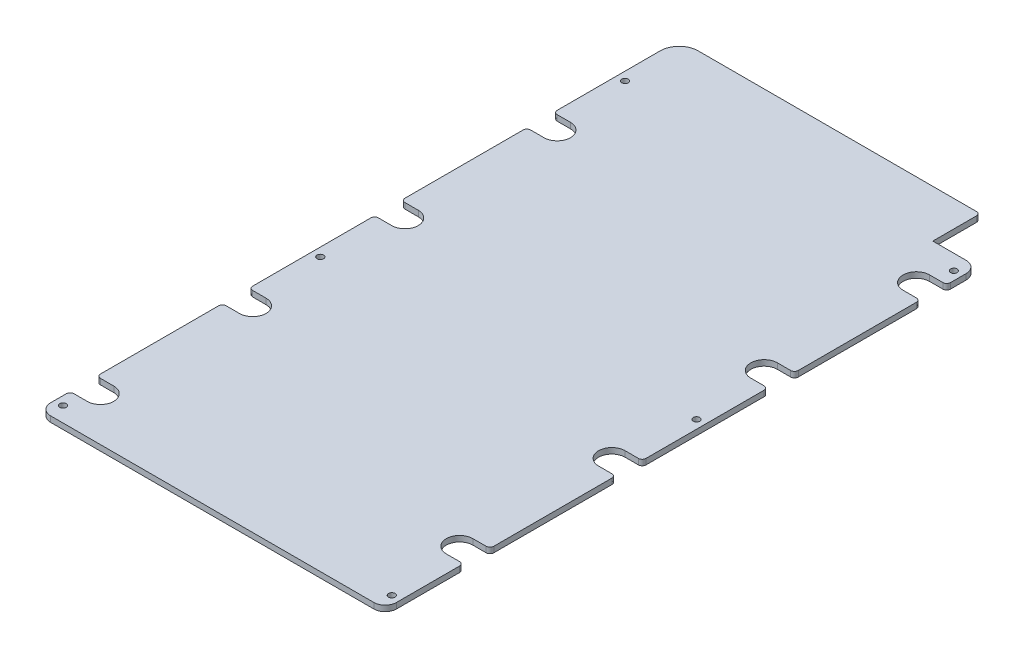
from build123d import *

# Parameters (mm, degrees)
SKETCH1_W                 = 158.69
SKETCH1_H                 = 25
BOSS_EXTRUDE1_DEPTH       = 3
FILLET1_R                 = 10
FILLET2_R                 = 6
F_4_CLEARANCE_HOLE1_D     = 3.4544
F_4_CLEARANCE_HOLE1_DEPTH = 3
F_4_CLEARANCE_HOLE1_TIP   = 1.037806461
FILLET3_R                 = 2


with BuildPart() as part:
    # Sketch1 → Boss-Extrude1 (new body)
    with BuildSketch(Plane(origin=(0, 0, 0), x_dir=(1, 0, 0), z_dir=(0, 1, 0))):
        with BuildLine():
            Line((-91.15, 34.609827366), (-82.15, 34.609827366))
            ThreePointArc((-82.15, 34.609827366), (-75.15, 27.609827366), (-82.15, 20.609827366))
            Line((-82.15, 20.609827366), (-91.15, 20.609827366))
            Line((-91.15, 20.609827366), (-91.15, -45.640172634))
            Line((-91.15, -45.640172634), (-82.15, -45.640172634))
            ThreePointArc((-82.15, -45.640172634), (-75.15, -52.640172634), (-82.15, -59.640172634))
            Line((-82.15, -59.640172634), (-91.15, -59.640172634))
            Line((-91.15, -59.640172634), (-91.15, -125.890172634))
            Line((-91.15, -125.890172634), (-82.15, -125.890172634))
            ThreePointArc((-82.15, -125.890172634), (-75.15, -132.890172634), (-82.15, -139.890172634))
            Line((-82.15, -139.890172634), (-91.15, -139.890172634))
            Line((-91.15, -139.890172634), (-91.15, -156.140172634))
            Line((-91.15, -156.140172634), (91.15, -156.140172634))
            Line((91.15, -156.140172634), (91.15, -114.890172634))
            Line((91.15, -114.890172634), (82.15, -114.890172634))
            ThreePointArc((82.15, -114.890172634), (75.15, -107.890172634), (82.15, -100.890172634))
            Line((82.15, -100.890172634), (91.15, -100.890172634))
            Line((91.15, -100.890172634), (91.15, -34.640172634))
            Line((91.15, -34.640172634), (82.15, -34.640172634))
            ThreePointArc((82.15, -34.640172634), (75.15, -27.640172634), (82.15, -20.640172634))
            Line((82.15, -20.640172634), (91.15, -20.640172634))
            Line((91.15, -20.640172634), (91.15, 45.609827366))
            Line((91.15, 45.609827366), (82.15, 45.609827366))
            ThreePointArc((82.15, 45.609827366), (75.15, 52.609827366), (82.15, 59.609827366))
            Line((82.15, 59.609827366), (91.15, 59.609827366))
            Line((91.15, 59.609827366), (91.15, 125.859827366))
            Line((91.15, 125.859827366), (82.15, 125.859827366))
            ThreePointArc((82.15, 125.859827366), (75.15, 132.859827366), (82.15, 139.859827366))
            Line((82.15, 139.859827366), (91.15, 139.859827366))
            Line((91.15, 139.859827366), (91.15, 156.140172634))
            Line((91.15, 156.140172634), (67.54, 156.140172634))
            Line((67.54, 156.140172634), (-91.15, 156.140172634))
            Line((-91.15, 156.140172634), (-91.15, 114.859827366))
            Line((-91.15, 114.859827366), (-82.15, 114.859827366))
            ThreePointArc((-82.15, 114.859827366), (-75.15, 107.859827366), (-82.15, 100.859827366))
            Line((-82.15, 100.859827366), (-91.15, 100.859827366))
            Line((-91.15, 100.859827366), (-91.15, 34.609827366))
        make_face()
        with Locations((-11.805, 168.640172634)):
            Rectangle(SKETCH1_W, SKETCH1_H)
    extrude(amount=BOSS_EXTRUDE1_DEPTH)

    # Fillet1
    fillet1_edges = [part.edges().sort_by_distance(p)[0] for p in [
        (-91.15, 1.5, -181.140172634),
    ]]
    fillet(fillet1_edges, radius=FILLET1_R)

    # Fillet2
    fillet2_edges = [part.edges().sort_by_distance(p)[0] for p in [
        (91.15, 1.5, 156.140172634),
        (-91.15, 1.5, 156.140172634),
        (91.15, 1.5, -156.140172634),
    ]]
    fillet(fillet2_edges, radius=FILLET2_R)

    # #4 Clearance Hole1
    with Locations(Plane(origin=(0, 3, 0), x_dir=(1, 0, 0), z_dir=(0, 1, 0))):
        with Locations((86.65, 148.140172634), (-86.65, -148.140172634), (-86.65, -12.515172634), (-86.65, 148.140172634), (86.65, 12.484827366), (86.65, -148.140172634)):
            Hole(F_4_CLEARANCE_HOLE1_D / 2, depth=F_4_CLEARANCE_HOLE1_DEPTH)
            with Locations((0, 0, -(F_4_CLEARANCE_HOLE1_DEPTH + F_4_CLEARANCE_HOLE1_TIP / 2))):  # 118° drill point
                Cone(0, F_4_CLEARANCE_HOLE1_D / 2, F_4_CLEARANCE_HOLE1_TIP, mode=Mode.SUBTRACT)

    # Fillet3
    fillet3_edges = [part.edges().sort_by_distance(p)[0] for p in [
        (67.54, 1.5, -181.140172634),
        (91.15, 1.5, -125.859827366),
        (91.15, 1.5, -59.609827366),
        (91.15, 1.5, -45.609827366),
        (91.15, 1.5, 20.640172634),
        (91.15, 1.5, 34.640172634),
        (91.15, 1.5, 100.890172634),
        (91.15, 1.5, 114.890172634),
        (-91.15, 1.5, 139.890172634),
        (-91.15, 1.5, 125.890172634),
        (-91.15, 1.5, 59.640172634),
        (-91.15, 1.5, 45.640172634),
        (-91.15, 1.5, -20.609827366),
        (-91.15, 1.5, -34.609827366),
        (-91.15, 1.5, -100.859827366),
        (-91.15, 1.5, -114.859827366),
        (91.15, 1.5, -139.859827366),
    ]]
    fillet(fillet3_edges, radius=FILLET3_R)


solid = part.part
